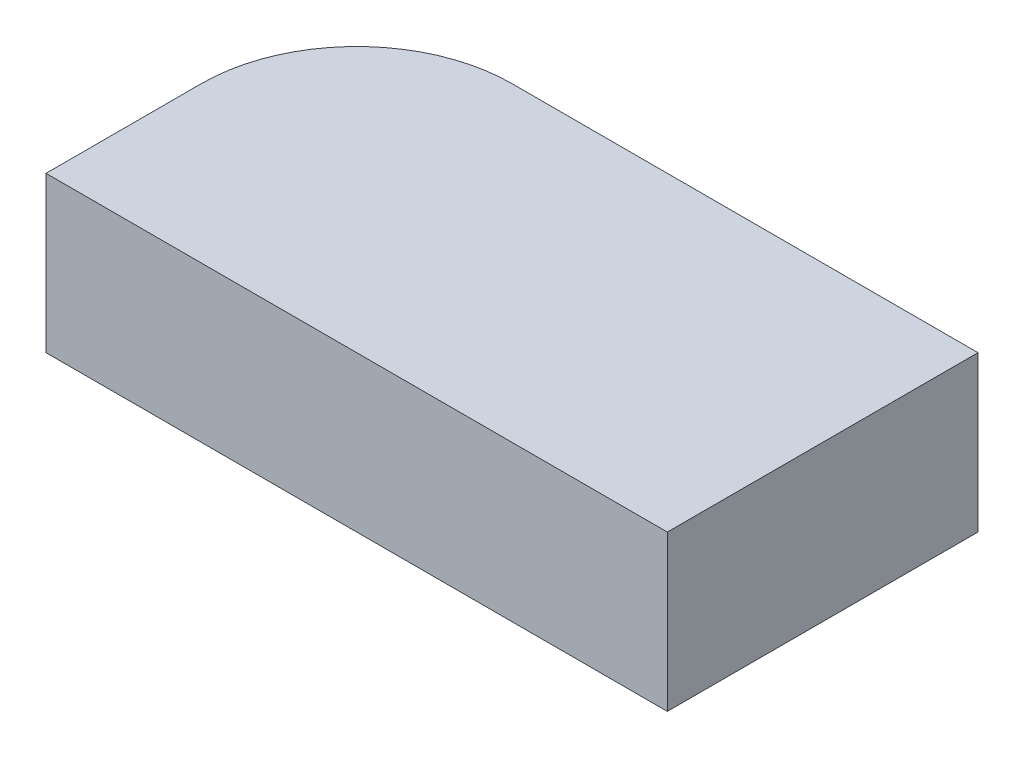
from build123d import *

# Parameters (mm, degrees)
BOSS_EXTRUDE1_DEPTH = 20


with BuildPart() as part:
    # Sketch1 → Boss-Extrude1 (new body)
    with BuildSketch(Plane(origin=(0, 0, 0), x_dir=(1, 0, 0), z_dir=(0, 1, 0))):
        with BuildLine():
            Line((0, 0), (60, 0))
            Line((60, 0), (60, -40))
            Line((60, -40), (-20, -40))
            Line((-20, -40), (-20, -20))
            ThreePointArc((-20, -20), (-14.142135624, -5.857864376), (0, 0))
        make_face()
    extrude(amount=BOSS_EXTRUDE1_DEPTH)


solid = part.part
